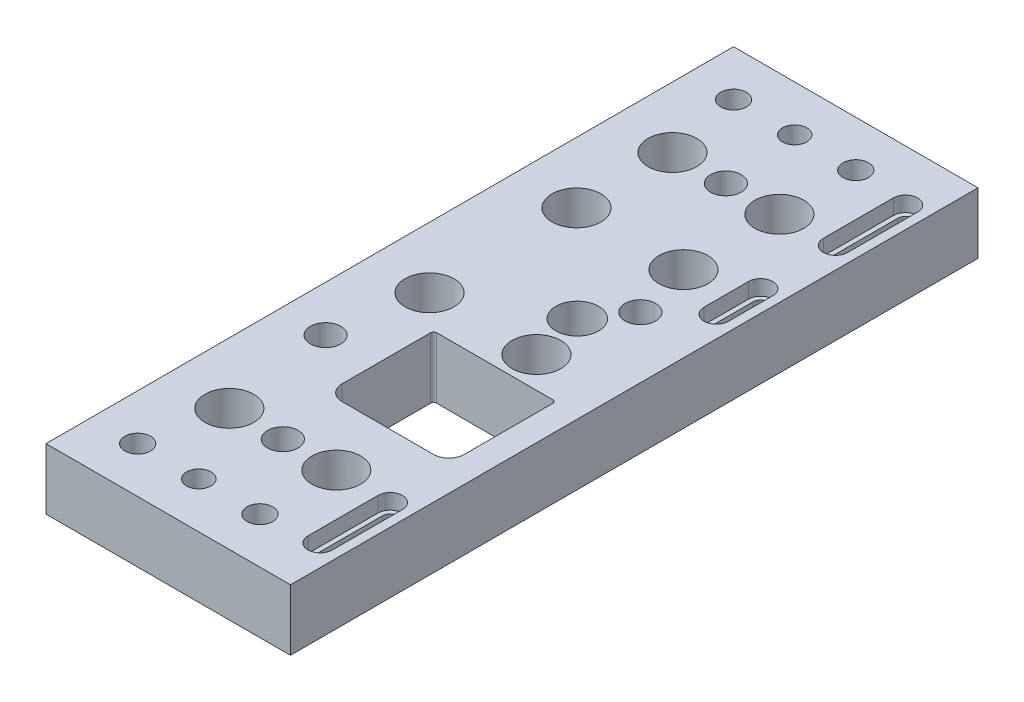
from build123d import *

# Parameters (mm, degrees)
SKETCH1_W                                    = 80
SKETCH1_H                                    = 225
BOSS_EXTRUDE1_DEPTH                          = 20
CUT_EXTRUDE1_REACH                           = 123.063
CUT_EXTRUDE2_REACH                           = 123.063
CUT_EXTRUDE3_DEPTH                           = 5
CBORE_FOR_M8_HEX_SOCKET_HEAD_CAP_SCR_2_COUNT = 2
CBORE_FOR_M8_HEX_SOCKET_HEAD_CAP_SCR_2_PITCH = 40
CBORE_FOR_M8_HEX_SOCKET_HEAD_CAP_SCR_3_COUNT = 2
CBORE_FOR_M8_HEX_SOCKET_HEAD_CAP_SCR_3_PITCH = 199.060292374
CBORE_FOR_M8_HEX_SOCKET_HEAD_CAP_SCR_4_COUNT = 2
CBORE_FOR_M8_HEX_SOCKET_HEAD_CAP_SCR_4_PITCH = 195
F_8_0MM_DOWEL_HOLE1_D                        = 8
F_8_0MM_DOWEL_HOLE1_CSINK_D                  = 8.05
F_8_0MM_DOWEL_HOLE1_CSINK_ANGLE              = 90
CUT_EXTRUDE4_REACH                           = 123.063
SKETCH13_R                                   = 8
CUT_EXTRUDE5_REACH                           = 123.063
SKETCH15_R                                   = 5
CUT_EXTRUDE6_REACH                           = 123.063
SKETCH17_R                                   = 7


with BuildPart() as part:
    # Sketch1 → Boss-Extrude1 (new body)
    with BuildSketch(Plane(origin=(0, 0, 0), x_dir=(1, 0, 0), z_dir=(0, 1, 0))):
        Rectangle(SKETCH1_W, SKETCH1_H)
    extrude(amount=-BOSS_EXTRUDE1_DEPTH)

    # Sketch2 → Cut-Extrude1 (cut, up to next)
    with BuildSketch(Plane(origin=(0, 0, 0), x_dir=(1, 0, 0), z_dir=(0, 1, 0)), mode=Mode.PRIVATE) as cut_extrude1_sk1:
        with BuildLine():
            Line((31.5, -47.14), (31.5, -18.14))
            ThreePointArc((31.5, -18.14), (31.207106781, -17.432893219), (30.5, -17.14))
            Line((30.5, -17.14), (-7.5, -17.14))
            ThreePointArc((-7.5, -17.14), (-8.207106781, -17.432893219), (-8.5, -18.14))
            Line((-8.5, -18.14), (-8.5, -47.14))
            ThreePointArc((-8.5, -47.14), (-7.035533906, -50.675533906), (-3.5, -52.14))
            Line((-3.5, -52.14), (26.5, -52.14))
            ThreePointArc((26.5, -52.14), (30.035533906, -50.675533906), (31.5, -47.14))
        make_face()
    cut_extrude1_tool1 = extrude(cut_extrude1_sk1.sketch, amount=-CUT_EXTRUDE1_REACH, mode=Mode.PRIVATE) & part.part
    add(cut_extrude1_tool1.solids().sort_by_distance((11.5, 0, 34.518764))[0], mode=Mode.SUBTRACT)

    # Sketch3 → Cut-Extrude2 (cut, up to next)
    with BuildSketch(Plane(origin=(0, 0, 0), x_dir=(1, 0, 0), z_dir=(0, 1, 0)), mode=Mode.PRIVATE) as cut_extrude2_sk1:
        with BuildLine():
            Line((35.5, -95.77), (35.5, -72.87))
            ThreePointArc((35.5, -72.87), (33, -70.37), (30.5, -72.87))
            Line((30.5, -72.87), (30.5, -95.77))
            ThreePointArc((30.5, -95.77), (33, -98.27), (35.5, -95.77))
        make_face()
    cut_extrude2_tool1 = extrude(cut_extrude2_sk1.sketch, amount=-CUT_EXTRUDE2_REACH, mode=Mode.PRIVATE) & part.part
    # Sketch3 → Cut-Extrude2 (cut, up to next)
    with BuildSketch(Plane(origin=(0, 0, 0), x_dir=(1, 0, 0), z_dir=(0, 1, 0)), mode=Mode.PRIVATE) as cut_extrude2_sk2:
        with BuildLine():
            Line((35.5, 33.86), (35.5, 48.36))
            ThreePointArc((35.5, 48.36), (33, 50.86), (30.5, 48.36))
            Line((30.5, 48.36), (30.5, 33.86))
            ThreePointArc((30.5, 33.86), (33, 31.36), (35.5, 33.86))
        make_face()
    cut_extrude2_tool2 = extrude(cut_extrude2_sk2.sketch, amount=-CUT_EXTRUDE2_REACH, mode=Mode.PRIVATE) & part.part
    # Sketch3 → Cut-Extrude2 (cut, up to next)
    with BuildSketch(Plane(origin=(0, 0, 0), x_dir=(1, 0, 0), z_dir=(0, 1, 0)), mode=Mode.PRIVATE) as cut_extrude2_sk3:
        with BuildLine():
            Line((35.5, 72.87), (35.5, 95.77))
            ThreePointArc((35.5, 95.77), (33, 98.27), (30.5, 95.77))
            Line((30.5, 95.77), (30.5, 72.87))
            ThreePointArc((30.5, 72.87), (33, 70.37), (35.5, 72.87))
        make_face()
    cut_extrude2_tool3 = extrude(cut_extrude2_sk3.sketch, amount=-CUT_EXTRUDE2_REACH, mode=Mode.PRIVATE) & part.part
    add(cut_extrude2_tool1.solids().sort_by_distance((33, 0, 84.32))[0], mode=Mode.SUBTRACT)
    add(cut_extrude2_tool2.solids().sort_by_distance((33, 0, -41.11))[0], mode=Mode.SUBTRACT)
    add(cut_extrude2_tool3.solids().sort_by_distance((33, 0, -84.32))[0], mode=Mode.SUBTRACT)

    # Sketch4 → Cut-Extrude3 (cut)
    with BuildSketch(Plane(origin=(0, 0, 0), x_dir=(1, 0, 0), z_dir=(0, 1, 0))):
        with BuildLine():
            Line((37, 72.87), (37, 95.77))
            ThreePointArc((37, 95.77), (33, 99.77), (29, 95.77))
            Line((29, 95.77), (29, 72.87))
            ThreePointArc((29, 72.87), (33, 68.87), (37, 72.87))
        make_face()
        with BuildLine():
            Line((37, 33.86), (37, 48.36))
            ThreePointArc((37, 48.36), (33, 52.36), (29, 48.36))
            Line((29, 48.36), (29, 33.86))
            ThreePointArc((29, 33.86), (33, 29.86), (37, 33.86))
        make_face()
        with BuildLine():
            Line((37, -95.77), (37, -72.87))
            ThreePointArc((37, -72.87), (33, -68.87), (29, -72.87))
            Line((29, -72.87), (29, -95.77))
            ThreePointArc((29, -95.77), (33, -99.77), (37, -95.77))
        make_face()
    extrude(amount=-CUT_EXTRUDE3_DEPTH, mode=Mode.SUBTRACT)

    # Sketch8 → CBORE for M8 Hex Socket Head Cap Screw1 (revolve, cut)
    with BuildSketch(Plane(origin=(-25, -20, -97.5), x_dir=(0, 0, -1), z_dir=(1, 0, 0))):
        Polygon((0, 0), (0, 20), (4.2, 20), (4.2, 8.6), (7.5, 8.6), (7.5, 0.025), (7.525, 0), align=None)
    cbore_for_m8_hex_socket_head_cap_screw1 = revolve(axis=Axis((-25, -26.35, -97.5), (0, 1, 0)), mode=Mode.SUBTRACT)

    # CBORE for M8 Hex Socket Head Cap Scr 2: CBORE for M8 Hex Socket Head Cap Screw1 ×2
    with Locations(*[(i * CBORE_FOR_M8_HEX_SOCKET_HEAD_CAP_SCR_2_PITCH, 0, 0) for i in range(1, CBORE_FOR_M8_HEX_SOCKET_HEAD_CAP_SCR_2_COUNT)]):
        add(cbore_for_m8_hex_socket_head_cap_screw1, mode=Mode.SUBTRACT)

    # CBORE for M8 Hex Socket Head Cap Scr 3: CBORE for M8 Hex Socket Head Cap Screw1 ×2
    with Locations(*[Vector(0.2009441437213313, 0, 0.9796027006414901) * (i * CBORE_FOR_M8_HEX_SOCKET_HEAD_CAP_SCR_3_PITCH) for i in range(1, CBORE_FOR_M8_HEX_SOCKET_HEAD_CAP_SCR_3_COUNT)]):
        add(cbore_for_m8_hex_socket_head_cap_screw1, mode=Mode.SUBTRACT)

    # CBORE for M8 Hex Socket Head Cap Scr 4: CBORE for M8 Hex Socket Head Cap Screw1 ×2
    with Locations(*[(0, 0, i * CBORE_FOR_M8_HEX_SOCKET_HEAD_CAP_SCR_4_PITCH) for i in range(1, CBORE_FOR_M8_HEX_SOCKET_HEAD_CAP_SCR_4_COUNT)]):
        add(cbore_for_m8_hex_socket_head_cap_screw1, mode=Mode.SUBTRACT)

    # Ø8.0mm Dowel Hole1 (through all)
    with Locations(Plane(origin=(0, -20, 0), x_dir=(-1, 0, 0), z_dir=(0, -1, 0))):
        with Locations((5, -97.5), (5, 97.5)):
            CounterSinkHole(F_8_0MM_DOWEL_HOLE1_D / 2, F_8_0MM_DOWEL_HOLE1_CSINK_D / 2, counter_sink_angle=F_8_0MM_DOWEL_HOLE1_CSINK_ANGLE)

    # Sketch13 → Cut-Extrude4 (cut, up to next)
    with BuildSketch(Plane(origin=(0, 0, 0), x_dir=(1, 0, 0), z_dir=(0, 1, 0)), mode=Mode.PRIVATE) as cut_extrude4_sk1:
        with Locations(Location((15, 41.11, 0), (0, 0, 270))):
            Circle(SKETCH13_R)
    cut_extrude4_tool1 = extrude(cut_extrude4_sk1.sketch, amount=-CUT_EXTRUDE4_REACH, mode=Mode.PRIVATE) & part.part
    # Sketch13 → Cut-Extrude4 (cut, up to next)
    with BuildSketch(Plane(origin=(0, 0, 0), x_dir=(1, 0, 0), z_dir=(0, 1, 0)), mode=Mode.PRIVATE) as cut_extrude4_sk2:
        with Locations(Location((15, -7, 0), (0, 0, 270))):
            Circle(SKETCH13_R)
    cut_extrude4_tool2 = extrude(cut_extrude4_sk2.sketch, amount=-CUT_EXTRUDE4_REACH, mode=Mode.PRIVATE) & part.part
    # Sketch13 → Cut-Extrude4 (cut, up to next)
    with BuildSketch(Plane(origin=(0, 0, 0), x_dir=(1, 0, 0), z_dir=(0, 1, 0)), mode=Mode.PRIVATE) as cut_extrude4_sk3:
        with Locations(Location((15, -72.5, 0), (0, 0, 270))):
            Circle(SKETCH13_R)
    cut_extrude4_tool3 = extrude(cut_extrude4_sk3.sketch, amount=-CUT_EXTRUDE4_REACH, mode=Mode.PRIVATE) & part.part
    # Sketch13 → Cut-Extrude4 (cut, up to next)
    with BuildSketch(Plane(origin=(0, 0, 0), x_dir=(1, 0, 0), z_dir=(0, 1, 0)), mode=Mode.PRIVATE) as cut_extrude4_sk4:
        with Locations(Location((-20, -72.5, 0), (0, 0, 270))):
            Circle(SKETCH13_R)
    cut_extrude4_tool4 = extrude(cut_extrude4_sk4.sketch, amount=-CUT_EXTRUDE4_REACH, mode=Mode.PRIVATE) & part.part
    # Sketch13 → Cut-Extrude4 (cut, up to next)
    with BuildSketch(Plane(origin=(0, 0, 0), x_dir=(1, 0, 0), z_dir=(0, 1, 0)), mode=Mode.PRIVATE) as cut_extrude4_sk5:
        with Locations(Location((-20, -7, 0), (0, 0, 270))):
            Circle(SKETCH13_R)
    cut_extrude4_tool5 = extrude(cut_extrude4_sk5.sketch, amount=-CUT_EXTRUDE4_REACH, mode=Mode.PRIVATE) & part.part
    # Sketch13 → Cut-Extrude4 (cut, up to next)
    with BuildSketch(Plane(origin=(0, 0, 0), x_dir=(1, 0, 0), z_dir=(0, 1, 0)), mode=Mode.PRIVATE) as cut_extrude4_sk6:
        with Locations(Location((-20, 41.11, 0), (0, 0, 270))):
            Circle(SKETCH13_R)
    cut_extrude4_tool6 = extrude(cut_extrude4_sk6.sketch, amount=-CUT_EXTRUDE4_REACH, mode=Mode.PRIVATE) & part.part
    # Sketch13 → Cut-Extrude4 (cut, up to next)
    with BuildSketch(Plane(origin=(0, 0, 0), x_dir=(1, 0, 0), z_dir=(0, 1, 0)), mode=Mode.PRIVATE) as cut_extrude4_sk7:
        with Locations(Location((-20, 72.5, 0), (0, 0, 270))):
            Circle(SKETCH13_R)
    cut_extrude4_tool7 = extrude(cut_extrude4_sk7.sketch, amount=-CUT_EXTRUDE4_REACH, mode=Mode.PRIVATE) & part.part
    # Sketch13 → Cut-Extrude4 (cut, up to next)
    with BuildSketch(Plane(origin=(0, 0, 0), x_dir=(1, 0, 0), z_dir=(0, 1, 0)), mode=Mode.PRIVATE) as cut_extrude4_sk8:
        with Locations(Location((15, 72.5, 0), (0, 0, 270))):
            Circle(SKETCH13_R)
    cut_extrude4_tool8 = extrude(cut_extrude4_sk8.sketch, amount=-CUT_EXTRUDE4_REACH, mode=Mode.PRIVATE) & part.part
    add(cut_extrude4_tool1.solids().sort_by_distance((15, 0, -41.11))[0], mode=Mode.SUBTRACT)
    add(cut_extrude4_tool2.solids().sort_by_distance((15, 0, 7))[0], mode=Mode.SUBTRACT)
    add(cut_extrude4_tool3.solids().sort_by_distance((15, 0, 72.5))[0], mode=Mode.SUBTRACT)
    add(cut_extrude4_tool4.solids().sort_by_distance((-20, 0, 72.5))[0], mode=Mode.SUBTRACT)
    add(cut_extrude4_tool5.solids().sort_by_distance((-20, 0, 7))[0], mode=Mode.SUBTRACT)
    add(cut_extrude4_tool6.solids().sort_by_distance((-20, 0, -41.11))[0], mode=Mode.SUBTRACT)
    add(cut_extrude4_tool7.solids().sort_by_distance((-20, 0, -72.5))[0], mode=Mode.SUBTRACT)
    add(cut_extrude4_tool8.solids().sort_by_distance((15, 0, -72.5))[0], mode=Mode.SUBTRACT)

    # Sketch15 → Cut-Extrude5 (cut, up to next)
    with BuildSketch(Plane(origin=(0, 0, 0), x_dir=(1, 0, 0), z_dir=(0, 1, 0)), mode=Mode.PRIVATE) as cut_extrude5_sk1:
        with Locations(Location((-2.5, -72.5, 0), (0, 0, 270))):
            Circle(SKETCH15_R)
    cut_extrude5_tool1 = extrude(cut_extrude5_sk1.sketch, amount=-CUT_EXTRUDE5_REACH, mode=Mode.PRIVATE) & part.part
    # Sketch15 → Cut-Extrude5 (cut, up to next)
    with BuildSketch(Plane(origin=(0, 0, 0), x_dir=(1, 0, 0), z_dir=(0, 1, 0)), mode=Mode.PRIVATE) as cut_extrude5_sk2:
        with Locations(Location((-25, -36, 0), (0, 0, 270))):
            Circle(SKETCH15_R)
    cut_extrude5_tool2 = extrude(cut_extrude5_sk2.sketch, amount=-CUT_EXTRUDE5_REACH, mode=Mode.PRIVATE) & part.part
    # Sketch15 → Cut-Extrude5 (cut, up to next)
    with BuildSketch(Plane(origin=(0, 0, 0), x_dir=(1, 0, 0), z_dir=(0, 1, 0)), mode=Mode.PRIVATE) as cut_extrude5_sk3:
        with Locations(Location((20, 22, 0), (0, 0, 270))):
            Circle(SKETCH15_R)
    cut_extrude5_tool3 = extrude(cut_extrude5_sk3.sketch, amount=-CUT_EXTRUDE5_REACH, mode=Mode.PRIVATE) & part.part
    # Sketch15 → Cut-Extrude5 (cut, up to next)
    with BuildSketch(Plane(origin=(0, 0, 0), x_dir=(1, 0, 0), z_dir=(0, 1, 0)), mode=Mode.PRIVATE) as cut_extrude5_sk4:
        with Locations(Location((-2.5, 72.5, 0), (0, 0, 270))):
            Circle(SKETCH15_R)
    cut_extrude5_tool4 = extrude(cut_extrude5_sk4.sketch, amount=-CUT_EXTRUDE5_REACH, mode=Mode.PRIVATE) & part.part
    add(cut_extrude5_tool1.solids().sort_by_distance((-2.5, 0, 72.5))[0], mode=Mode.SUBTRACT)
    add(cut_extrude5_tool2.solids().sort_by_distance((-25, 0, 36))[0], mode=Mode.SUBTRACT)
    add(cut_extrude5_tool3.solids().sort_by_distance((20, 0, -22))[0], mode=Mode.SUBTRACT)
    add(cut_extrude5_tool4.solids().sort_by_distance((-2.5, 0, -72.5))[0], mode=Mode.SUBTRACT)

    # Sketch17 → Cut-Extrude6 (cut, up to next)
    with BuildSketch(Plane(origin=(0, 0, 0), x_dir=(1, 0, 0), z_dir=(0, 1, 0)), mode=Mode.PRIVATE) as cut_extrude6_sk1:
        with Locations(Location((11.5, 9.86, 0), (0, 0, 270))):
            Circle(SKETCH17_R)
    cut_extrude6_tool1 = extrude(cut_extrude6_sk1.sketch, amount=-CUT_EXTRUDE6_REACH, mode=Mode.PRIVATE) & part.part
    add(cut_extrude6_tool1.solids().sort_by_distance((11.5, 0, -9.86))[0], mode=Mode.SUBTRACT)


solid = part.part
